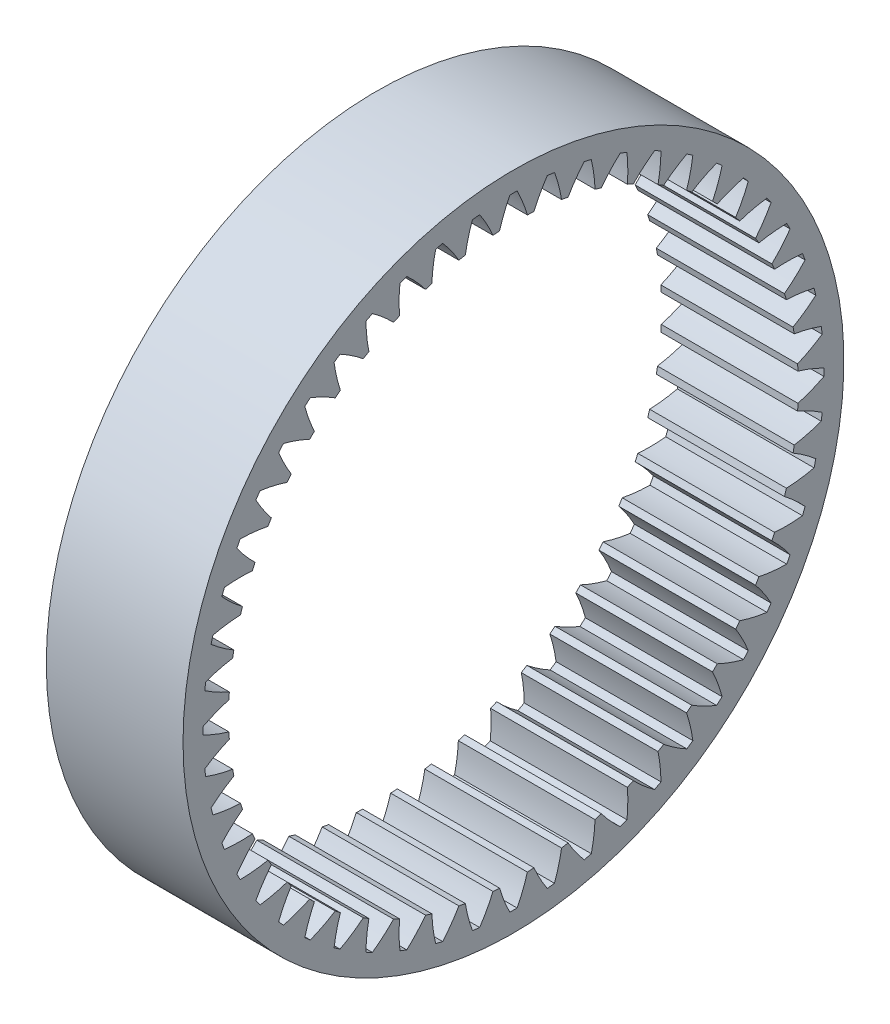
from build123d import *

# Parameters (mm, degrees)
BASPROSKE_W     = 12
BASPROSKE_H     = 4
TOOTHCUT_DEPTH  = 43.731721238
TEETHCUTS_COUNT = 52


with BuildPart() as part:
    # BasProSke → Base-Revolve (revolve)
    with BuildSketch(Plane(origin=(0, 0, 0), x_dir=(1, 0, 0), z_dir=(0, 1, 0)), mode=Mode.PRIVATE) as base_revolve_sk:
        with Locations((6, 27)):
            Rectangle(BASPROSKE_W, BASPROSKE_H)
    revolve(base_revolve_sk.sketch.rotate(Axis((-10, 0, 0), (1, 0, 0)), 180), axis=Axis((-10, 0, 0), (1, 0, 0)))

    # TooCutSke → ToothCut (cut, through all)
    with BuildSketch(Plane(origin=(0, 0, 0), x_dir=(0, 0, -1), z_dir=(1, 0, 0))):
        with BuildLine():
            ThreePointArc((1.228102844, 24.944386314), (0.828505664, 26.11847141), (0.318844637, 27.249134649))
            ThreePointArc((0.318844637, 27.249134649), (0, 27.251), (-0.318844637, 27.249134649))
            ThreePointArc((-0.318844637, 27.249134649), (-0.828505664, 26.11847141), (-1.228102844, 24.944386314))
            ThreePointArc((-1.228102844, 24.944386314), (0, 24.9746), (1.228102844, 24.944386314))
        make_face()
    toothcut = extrude(amount=TOOTHCUT_DEPTH, mode=Mode.SUBTRACT)

    # TeethCuts: ToothCut ×52 about axis
    teethcuts_axis = Axis((0, 0, 0), (1, 0, 0))
    for i in range(1, TEETHCUTS_COUNT):
        add(toothcut.rotate(teethcuts_axis, i * 360 / TEETHCUTS_COUNT), mode=Mode.SUBTRACT)


solid = part.part
